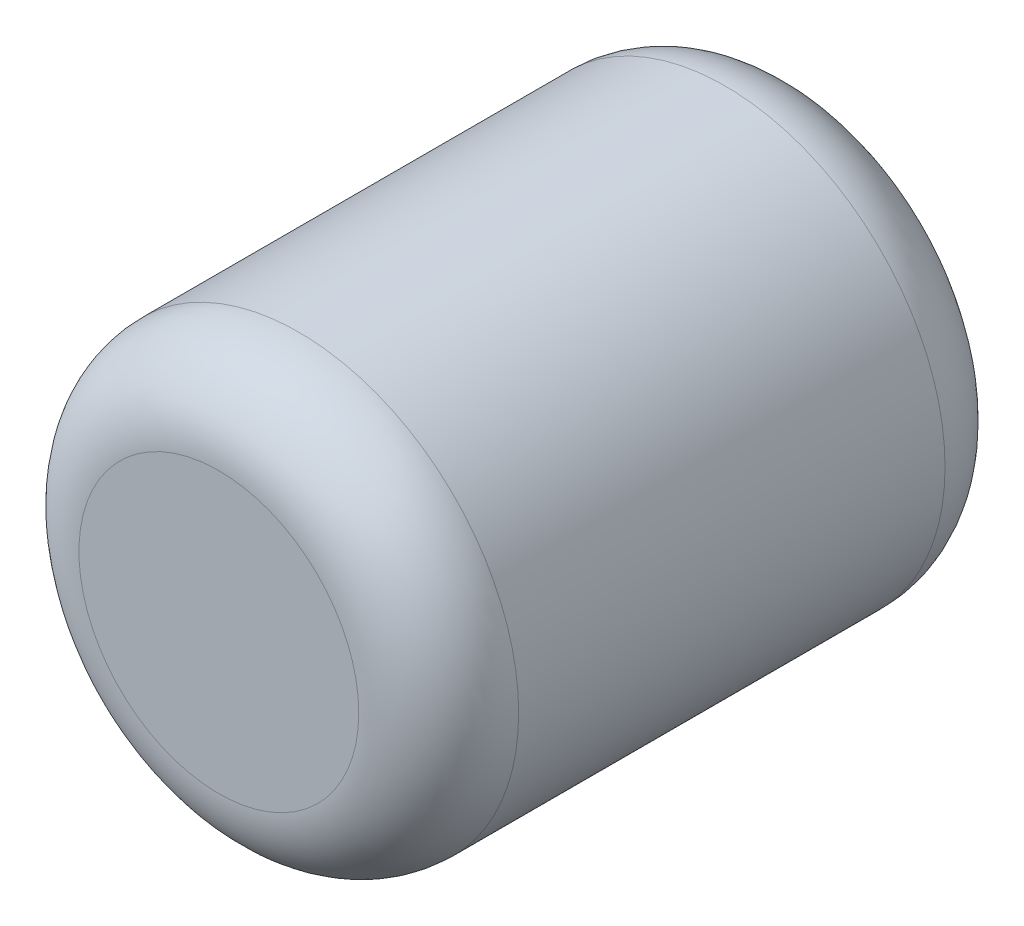
from build123d import *

# Parameters (mm, degrees)
SKETCH2_R           = 8.25
BOSS_EXTRUDE1_DEPTH = 22
FILLET1_R           = 3


with BuildPart() as part:
    # Sketch2 → Boss-Extrude1 (new body)
    with BuildSketch(Plane.XY):
        Circle(SKETCH2_R)
    extrude(amount=BOSS_EXTRUDE1_DEPTH)

    # Fillet1
    fillet1_edges = [part.edges().sort_by_distance(p)[0] for p in [
        (-8.25, 0, 0),
        (-8.25, 0, 22),
    ]]
    fillet(fillet1_edges, radius=FILLET1_R)


solid = part.part
